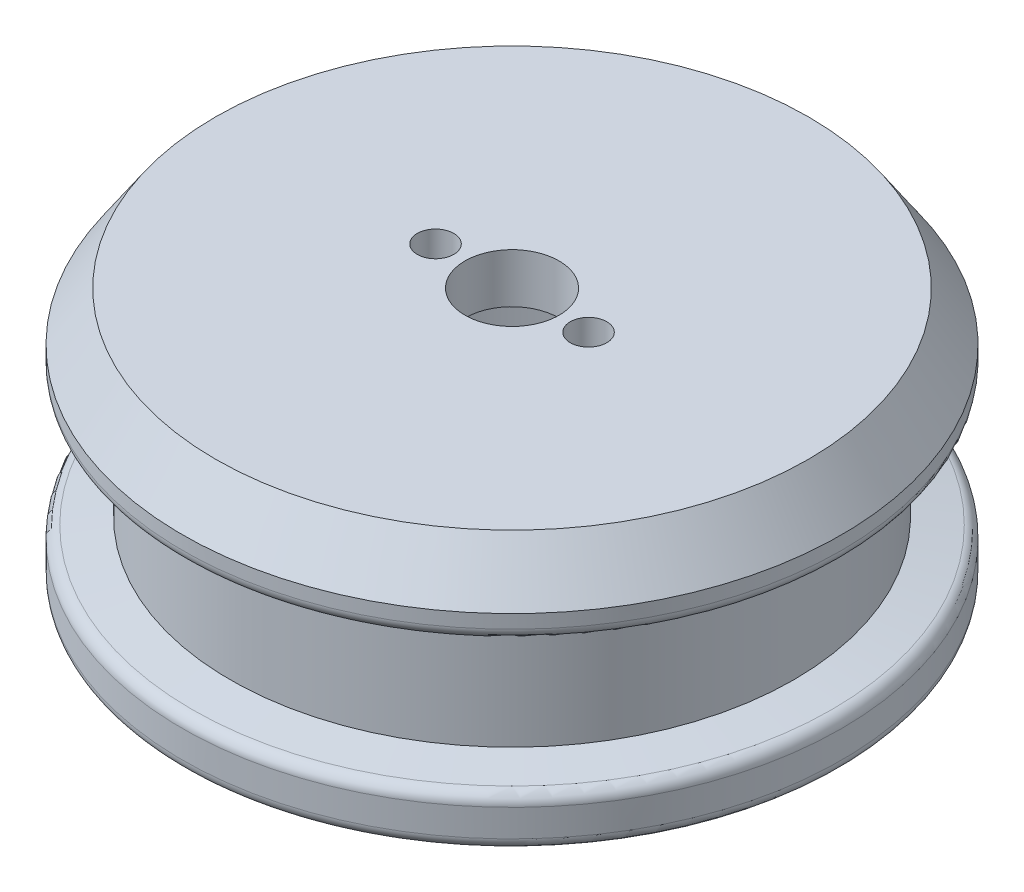
from build123d import *

# Parameters (mm, degrees)
SKETCH_3_R          = 1.55
CUT_EXTRUDE_1_DEPTH = 10
FILLET_1_R          = 1
FILLET_2_R          = 1
FILLET_3_R          = 1


with BuildPart() as part:
    # 草图1 → 旋转1 (revolve)
    with BuildSketch(Plane.XY, mode=Mode.PRIVATE) as revolve_1_sk:
        Polygon((28, 36.720931937), (28, 37.879871974), (23.939022146, 38.595931937), (23.939022146, 48.595931937), (28, 49.311991901), (28, 51.299673955), (25.1937626, 55.456960988), (4, 55.456960988), (4, 51.256921373), (18.3, 51.256921373), (22, 45.775573993), (22, 36.720931937), (22, 33.720931937), (28, 33.720931937), align=None)
    revolve(revolve_1_sk.sketch.rotate(Axis((0, 76.906520748, 0), (0, -1, 0)), 180), axis=Axis((0, 76.906520748, 0), (0, -1, 0)))

    # 草图3 → 切除-拉伸1 (cut)
    with BuildSketch(Plane(origin=(0, 55.456960988, 0), x_dir=(1, 0, 0), z_dir=(0, 1, 0))):
        with Locations(Location((-6.5, 0, 0), (0, 0, 270))):
            Circle(SKETCH_3_R)
        with Locations(Location((6.5, 0, 0), (0, 0, 180))):
            Circle(SKETCH_3_R)
    extrude(amount=-CUT_EXTRUDE_1_DEPTH, mode=Mode.SUBTRACT)

    # 圆角1
    fillet_1_edges = [part.edges().sort_by_distance(p)[0] for p in [
        (28, 49.311991901, 0),
    ]]
    fillet(fillet_1_edges, radius=FILLET_1_R)

    # 圆角2
    fillet_2_edges = [part.edges().sort_by_distance(p)[0] for p in [
        (28, 37.879871974, 0),
    ]]
    fillet(fillet_2_edges, radius=FILLET_2_R)

    # 圆角3
    fillet_3_edges = [part.edges().sort_by_distance(p)[0] for p in [
        (28, 33.720931937, 0),
    ]]
    fillet(fillet_3_edges, radius=FILLET_3_R)


solid = part.part
